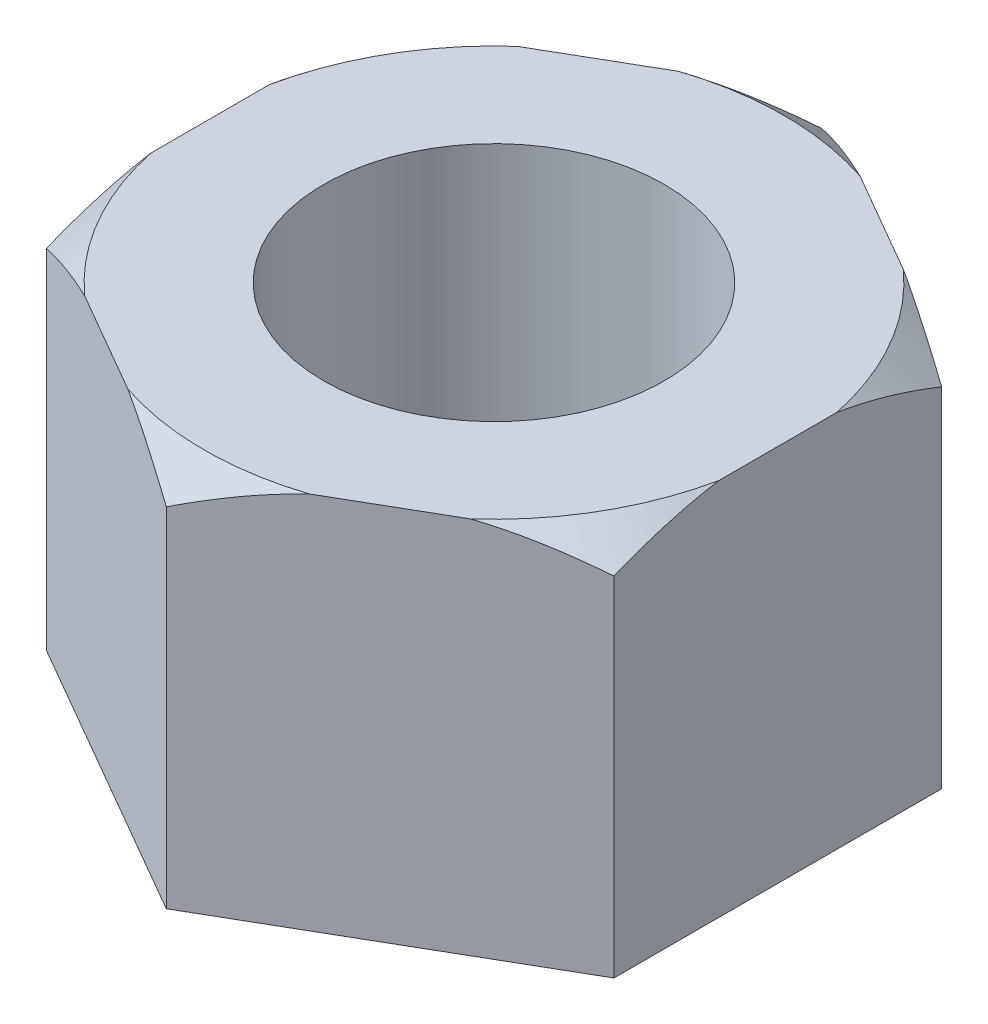
from build123d import *

# Parameters (mm, degrees)
BOSS_EXTRUDE1_DEPTH = 10
SKETCH2_R           = 4.5
CUT_EXTRUDE1_DEPTH  = 10


with BuildPart() as part:
    # Sketch1 → Boss-Extrude1 (new body)
    with BuildSketch(Plane(origin=(0, 0, 0), x_dir=(1, 0, 0), z_dir=(0, 1, 0))):
        Polygon((7.5, 4.330127019), (0, 8.660254038), (-7.5, 4.330127019), (-7.5, -4.330127019), (0, -8.660254038), (7.5, -4.330127019), align=None)
    extrude(amount=BOSS_EXTRUDE1_DEPTH)

    # Sketch3 → Cut-Revolve1 (revolve, cut)
    with BuildSketch(Plane(origin=(0, 0, 0), x_dir=(0, 0, -1), z_dir=(1, 0, 0))):
        Polygon((-8.660254038, 10), (-7.660254038, 10), (-8.660254038, 9.2), align=None)
    revolve(axis=Axis((0, 0, 0), (0, 1, 0)), mode=Mode.SUBTRACT)

    # Sketch2 → Cut-Extrude1 (cut)
    with BuildSketch(Plane(origin=(0, 10, 0), x_dir=(1, 0, 0), z_dir=(0, 1, 0))):
        with Locations(Location((0, 0, 0), (0, 0, 270))):
            Circle(SKETCH2_R)
    extrude(amount=-CUT_EXTRUDE1_DEPTH, mode=Mode.SUBTRACT)


solid = part.part
